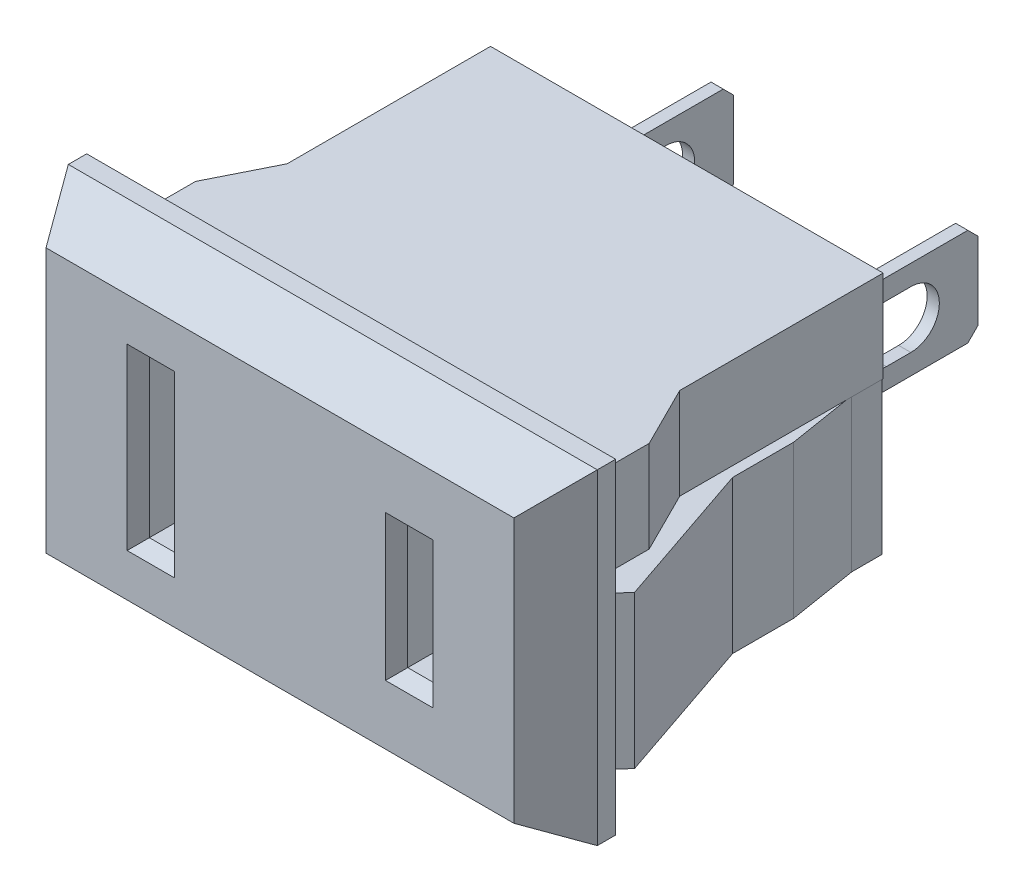
from build123d import *

# Parameters (mm, degrees)
BOSS_EXTRUDE1_DEPTH = 16
SKETCH2_W           = 1.5
SKETCH2_H           = 16
BOSS_EXTRUDE2_DEPTH = 0.8
SKETCH3_W           = 16.5
SKETCH3_H           = 16
BOSS_EXTRUDE3_DEPTH = 20.8
SKETCH4_W           = 24.15
SKETCH4_H           = 16
BOSS_EXTRUDE4_DEPTH = 3.5
CUT_EXTRUDE1_DEPTH  = 6.5
CUT_EXTRUDE2_DEPTH  = 2
CUT_EXTRUDE3_DEPTH  = 2
SKETCH8_W           = 3
SKETCH8_H           = 7
CUT_EXTRUDE4_DEPTH  = 2.5
CUT_EXTRUDE5_DEPTH  = 1
SKETCH10_W          = 3.5
SKETCH10_H          = 16
BOSS_EXTRUDE5_DEPTH = 1.85
SKETCH11_W          = 2
SKETCH11_H          = 16.5
CUT_EXTRUDE6_DEPTH  = 9.8
SKETCH12_W          = 16.5
SKETCH12_H          = 1
CUT_EXTRUDE7_DEPTH  = 5.5
BOSS_EXTRUDE6_DEPTH = 7.5
CUT_EXTRUDE8_DEPTH  = 7.5
CUT_EXTRUDE9_DEPTH  = 7.5
SKETCH16_W          = 0.6
SKETCH16_H          = 7
BOSS_EXTRUDE7_DEPTH = 8
SKETCH17_W          = 6.5
SKETCH17_H          = 1.1
CUT_EXTRUDE10_DEPTH = 33.205641493
SKETCH18_W          = 6.5
SKETCH18_H          = 1.1
CUT_EXTRUDE11_DEPTH = 33.205641493
SKETCH19_W          = 0.6
SKETCH19_H          = 7
BOSS_EXTRUDE8_DEPTH = 8
SKETCH20_W          = 6.5
SKETCH20_H          = 1.1
CUT_EXTRUDE12_DEPTH = 32.849473214
SKETCH21_W          = 6.5
SKETCH21_H          = 1.1
CUT_EXTRUDE13_DEPTH = 32.849473214
CUT_EXTRUDE14_REACH = 33.068
CUT_EXTRUDE15_REACH = 34.206
CUT_EXTRUDE16_DEPTH = 32.849473214
CUT_EXTRUDE17_DEPTH = 7.5
CUT_EXTRUDE18_DEPTH = 1.5
CUT_EXTRUDE19_DEPTH = 1.5
SKETCH28_W          = 1.524
SKETCH28_H          = 7.988
CUT_EXTRUDE20_DEPTH = 18
SKETCH29_W          = 1.524
SKETCH29_H          = 6.35
CUT_EXTRUDE21_DEPTH = 18
CHAMFER1_SIZE       = 0.5
CHAMFER2_SIZE       = 0.528136002
CHAMFER2_SIZE2      = 0.608008164
CHAMFER3_SIZE       = 0.4
CHAMFER3_SIZE2      = 0.692820323
CHAMFER4_SIZE       = 0.608008164
CHAMFER4_SIZE2      = 0.528136002
CHAMFER5_SIZE       = 1.5
CHAMFER5_SIZE2      = 2.598076211


with BuildPart() as part:
    # Sketch1 → Boss-Extrude1 (new body)
    with BuildSketch(Plane.XZ.offset(8)):
        Polygon((12.803267754, -0.8), (9.65, -0.8), (9.65, -14.690909091), (10.15, -11.6), (10.15, -8.6), align=None)
    extrude(amount=-BOSS_EXTRUDE1_DEPTH)

    # Sketch2 → Boss-Extrude2 (add)
    with BuildSketch(Plane.XY.offset(-0.8)):
        with Locations((10.4, 0)):
            Rectangle(SKETCH2_W, SKETCH2_H)
    extrude(amount=BOSS_EXTRUDE2_DEPTH)

    # Sketch3 → Boss-Extrude3 (add)
    with BuildSketch(Plane.ZY.offset(-9.65)):
        with Locations((-8.25, 0)):
            Rectangle(SKETCH3_W, SKETCH3_H)
    extrude(amount=BOSS_EXTRUDE3_DEPTH)

    # Sketch4 → Boss-Extrude4 (add)
    with BuildSketch(Plane.XY):
        with Locations((0.925, 0)):
            Rectangle(SKETCH4_W, SKETCH4_H)
    extrude(amount=BOSS_EXTRUDE4_DEPTH)

    # Sketch5 → Cut-Extrude1 (cut)
    with BuildSketch(Plane(origin=(0, 8, 0), x_dir=(-1, 0, 0), z_dir=(0, 1, 0))):
        Polygon((-9.65, -14.690909091), (-9.65, -6.5), (-11.15, -3.5), (-11.15, -0.8), (-12.803267754, -0.8), (-10.15, -8.6), (-10.15, -11.6), align=None)
    extrude(amount=-CUT_EXTRUDE1_DEPTH, mode=Mode.SUBTRACT)

    # Sketch6 → Cut-Extrude2 (cut)
    with BuildSketch(Plane(origin=(0, 8, 0), x_dir=(-1, 0, 0), z_dir=(0, 1, 0))):
        Polygon((-11.15, 0), (-11.15, -3.5), (-9.65, -6.5), (-9.65, -16.5), (11.15, -16.5), (11.15, 0), align=None)
    extrude(amount=-CUT_EXTRUDE2_DEPTH, mode=Mode.SUBTRACT)

    # Sketch7 → Cut-Extrude3 (cut)
    with BuildSketch(Plane.XZ.offset(8)):
        Polygon((11.15, -0.8), (11.15, 0), (-11.15, 0), (-11.15, -16.5), (9.65, -16.5), (9.65, -14.690909091), (10.15, -11.6), (10.15, -8.6), (12.803267754, -0.8), align=None)
    extrude(amount=-CUT_EXTRUDE3_DEPTH, mode=Mode.SUBTRACT)

    # Sketch8 → Cut-Extrude4 (cut)
    with BuildSketch(Plane.XZ.offset(6)):
        with Locations((0, -3.5)):
            Rectangle(SKETCH8_W, SKETCH8_H)
    extrude(amount=-CUT_EXTRUDE4_DEPTH, mode=Mode.SUBTRACT)

    # Sketch9 → Cut-Extrude5 (cut)
    with BuildSketch(Plane.XZ.offset(6)):
        Polygon((-1.5, -7), (-1.5, -16.5), (7, -16.5), (7, 0), (1.5, 0), (1.5, -7), align=None)
    extrude(amount=-CUT_EXTRUDE5_DEPTH, mode=Mode.SUBTRACT)

    # Sketch10 → Boss-Extrude5 (add)
    with BuildSketch(Plane.ZY.offset(11.15)):
        with Locations((1.75, 0)):
            Rectangle(SKETCH10_W, SKETCH10_H)
    extrude(amount=BOSS_EXTRUDE5_DEPTH)

    # Sketch11 → Cut-Extrude6 (cut)
    with BuildSketch(Plane.XZ.offset(6)):
        with Locations((-10.15, -8.25)):
            Rectangle(SKETCH11_W, SKETCH11_H)
    extrude(amount=-CUT_EXTRUDE6_DEPTH, mode=Mode.SUBTRACT)

    # Sketch12 → Cut-Extrude7 (cut)
    with BuildSketch(Plane(origin=(-1.5, 0, 0), x_dir=(0, 0, -1), z_dir=(1, 0, 0))):
        with Locations((8.25, -5.5)):
            Rectangle(SKETCH12_W, SKETCH12_H)
    extrude(amount=-CUT_EXTRUDE7_DEPTH, mode=Mode.SUBTRACT)

    # Sketch13 → Boss-Extrude6 (add)
    with BuildSketch(Plane.XZ.offset(6)):
        Polygon((-9.15, -6.566987298), (-10.695259589, -0.8), (-12.803267754, -0.8), (-10.15, -8.6), (-10.15, -11.6), (-9.6, -15), (-9.6, -16.5), (-9.15, -16.5), align=None)
    extrude(amount=-BOSS_EXTRUDE6_DEPTH)

    # Sketch14 → Cut-Extrude8 (cut)
    with BuildSketch(Plane.XZ.offset(6)):
        with BuildLine():
            Line((-9.15, 0), (-9.15, -6.566987298))
            Line((-9.15, -6.566987298), (-8.9, -7.5))
            Line((-8.9, -7.5), (-8.9, -9.5))
            ThreePointArc((-8.9, -9.5), (-8.45, -9.95), (-8, -9.5))
            Line((-8, -9.5), (-8, 0))
            Line((-8, 0), (-9.15, 0))
        make_face()
    extrude(amount=-CUT_EXTRUDE8_DEPTH, mode=Mode.SUBTRACT)

    # Sketch15 → Cut-Extrude9 (cut)
    with BuildSketch(Plane.XZ.offset(6)):
        with BuildLine():
            Line((8.9, -9.5), (8.9, -7.5))
            Line((8.9, -7.5), (10.695259589, -0.8))
            Line((10.695259589, -0.8), (11.15, -0.8))
            Line((11.15, -0.8), (11.15, 0))
            Line((11.15, 0), (8, 0))
            Line((8, 0), (8, -9.5))
            ThreePointArc((8, -9.5), (8.45, -9.95), (8.9, -9.5))
        make_face()
    extrude(amount=-CUT_EXTRUDE9_DEPTH, mode=Mode.SUBTRACT)

    # Sketch16 → Boss-Extrude7 (add)
    with BuildSketch(Plane(origin=(0, 0, -16.5), x_dir=(-1, 0, 0), z_dir=(0, 0, -1))):
        with Locations((-6.012, 0)):
            Rectangle(SKETCH16_W, SKETCH16_H)
    extrude(amount=BOSS_EXTRUDE7_DEPTH)

    # Sketch17 → Cut-Extrude10 (cut, through all)
    with BuildSketch(Plane(origin=(6.312, 0, 0), x_dir=(0, 0, -1), z_dir=(1, 0, 0))):
        with Locations((21.25, 2.95)):
            Rectangle(SKETCH17_W, SKETCH17_H)
    extrude(amount=-CUT_EXTRUDE10_DEPTH, mode=Mode.SUBTRACT)

    # Sketch18 → Cut-Extrude11 (cut, through all)
    with BuildSketch(Plane(origin=(6.312, 0, 0), x_dir=(0, 0, -1), z_dir=(1, 0, 0))):
        with Locations((21.25, -2.95)):
            Rectangle(SKETCH18_W, SKETCH18_H)
    extrude(amount=-CUT_EXTRUDE11_DEPTH, mode=Mode.SUBTRACT)

    # Sketch19 → Boss-Extrude8 (add)
    with BuildSketch(Plane(origin=(0, 0, -16.5), x_dir=(-1, 0, 0), z_dir=(0, 0, -1))):
        with Locations((6.012, 0)):
            Rectangle(SKETCH19_W, SKETCH19_H)
    extrude(amount=BOSS_EXTRUDE8_DEPTH)

    # Sketch20 → Cut-Extrude12 (cut, through all)
    with BuildSketch(Plane(origin=(-5.712, 0, 0), x_dir=(0, 0, -1), z_dir=(1, 0, 0))):
        with Locations((21.25, 2.95)):
            Rectangle(SKETCH20_W, SKETCH20_H)
    extrude(amount=-CUT_EXTRUDE12_DEPTH, mode=Mode.SUBTRACT)

    # Sketch21 → Cut-Extrude13 (cut, through all)
    with BuildSketch(Plane(origin=(-5.712, 0, 0), x_dir=(0, 0, -1), z_dir=(1, 0, 0))):
        with Locations((21.25, -2.95)):
            Rectangle(SKETCH21_W, SKETCH21_H)
    extrude(amount=-CUT_EXTRUDE13_DEPTH, mode=Mode.SUBTRACT)

    # Sketch22 → Cut-Extrude14 (cut, up to next)
    with BuildSketch(Plane(origin=(0, 6, 0), x_dir=(-1, 0, 0), z_dir=(0, 1, 0)), mode=Mode.PRIVATE) as cut_extrude14_sk1:
        Polygon((11.15, -3.5), (9.65, -6.5), (9.65, -16.5), (11.15, -16.5), align=None)
    cut_extrude14_tool1 = extrude(cut_extrude14_sk1.sketch, amount=-CUT_EXTRUDE14_REACH, mode=Mode.PRIVATE) & part.part
    add(cut_extrude14_tool1.solids().sort_by_distance((-10.432609, 6, -10.717391))[0], mode=Mode.SUBTRACT)

    # Sketch23 → Cut-Extrude15 (cut, up to next)
    with BuildSketch(Plane(origin=(6.312, 0, 0), x_dir=(0, 0, -1), z_dir=(1, 0, 0)), mode=Mode.PRIVATE) as cut_extrude15_sk1:
        with BuildLine():
            Line((20, -1.4), (21.2, -1.4))
            ThreePointArc((21.2, -1.4), (22.6, 0), (21.2, 1.4))
            Line((21.2, 1.4), (20, 1.4))
            ThreePointArc((20, 1.4), (18.6, 0), (20, -1.4))
        make_face()
    cut_extrude15_tool1 = extrude(cut_extrude15_sk1.sketch, amount=-CUT_EXTRUDE15_REACH, mode=Mode.PRIVATE) & part.part
    add(cut_extrude15_tool1.solids().sort_by_distance((6.312, 0, -20.6))[0], mode=Mode.SUBTRACT)

    # Sketch24 → Cut-Extrude16 (cut, through all)
    with BuildSketch(Plane(origin=(-5.712, 0, 0), x_dir=(0, 0, -1), z_dir=(1, 0, 0))):
        with BuildLine():
            Line((20, -1.4), (21.2, -1.4))
            ThreePointArc((21.2, -1.4), (22.6, 0), (21.2, 1.4))
            Line((21.2, 1.4), (20, 1.4))
            ThreePointArc((20, 1.4), (18.6, 0), (20, -1.4))
        make_face()
    extrude(amount=-CUT_EXTRUDE16_DEPTH, mode=Mode.SUBTRACT)

    # Sketch25 → Cut-Extrude17 (cut)
    with BuildSketch(Plane.XZ.offset(6)):
        Polygon((9.6, -15), (9.6, -16.5), (9.65, -16.5), (9.65, -14.690909091), align=None)
    extrude(amount=-CUT_EXTRUDE17_DEPTH, mode=Mode.SUBTRACT)

    # Sketch26 → Cut-Extrude18 (cut)
    with BuildSketch(Plane.XZ.offset(5)):
        Polygon((2.2, -13.5), (3.191, -13.5), (3.191, -8.5), (1, -8.5), (1, -12.7), (2.2, -12.7), align=None)
    extrude(amount=-CUT_EXTRUDE18_DEPTH, mode=Mode.SUBTRACT)

    # Sketch27 → Cut-Extrude19 (cut)
    with BuildSketch(Plane.XZ.offset(5)):
        Polygon((-2.2, -13.5), (-2.2, -12.7), (-1, -12.7), (-1, -8.5), (-3.191, -8.5), (-3.191, -13.5), align=None)
    extrude(amount=-CUT_EXTRUDE19_DEPTH, mode=Mode.SUBTRACT)

    # Sketch28 → Cut-Extrude20 (cut)
    with BuildSketch(Plane.XY.offset(3.5)):
        with Locations((-6.35, 0)):
            Rectangle(SKETCH28_W, SKETCH28_H)
    extrude(amount=-CUT_EXTRUDE20_DEPTH, mode=Mode.SUBTRACT)

    # Sketch29 → Cut-Extrude21 (cut)
    with BuildSketch(Plane.XY.offset(3.5)):
        with Locations((6.35, 0)):
            Rectangle(SKETCH29_W, SKETCH29_H)
    extrude(amount=-CUT_EXTRUDE21_DEPTH, mode=Mode.SUBTRACT)

    # Chamfer1
    chamfer1_edges = [part.edges().sort_by_distance(p)[0] for p in [
        (6.012, 2.4, -24.5),
        (6.012, -2.4, -24.5),
        (-6.012, 2.4, -24.5),
        (-6.012, -2.4, -24.5),
    ]]
    chamfer(chamfer1_edges, length=CHAMFER1_SIZE)

    # Chamfer2
    chamfer2_edges = [part.edges().sort_by_distance(p)[0] for p in [
        (-12.803267754, -2.25, -0.8),
    ]]
    chamfer2_side = [part.faces().sort_by_distance(p)[0] for p in [
        (-11.476633877, -2.25, -4.7),
    ]]
    chamfer(chamfer2_edges, length=CHAMFER2_SIZE, length2=CHAMFER2_SIZE2, reference=chamfer2_side[0])

    # Chamfer3
    chamfer3_edges = [part.edges().sort_by_distance(p)[0] for p in [
        (-6.35, -3.994, 3.5),
        (-5.588, 0, 3.5),
        (-6.35, 3.994, 3.5),
        (-7.112, 0, 3.5),
        (6.35, -3.175, 3.5),
        (7.112, 0, 3.5),
        (6.35, 3.175, 3.5),
        (5.588, 0, 3.5),
    ]]
    chamfer3_side = [part.faces().sort_by_distance(p)[0] for p in [
        (0.040217242, 0, 3.5),
    ]]
    chamfer(chamfer3_edges, length=CHAMFER3_SIZE, length2=CHAMFER3_SIZE2, reference=chamfer3_side[0])

    # Chamfer4
    chamfer4_edges = [part.edges().sort_by_distance(p)[0] for p in [
        (12.803267754, -2.25, -0.8),
    ]]
    chamfer4_side = [part.faces().sort_by_distance(p)[0] for p in [
        (11.749263671, -2.25, -0.8),
    ]]
    chamfer(chamfer4_edges, length=CHAMFER4_SIZE, length2=CHAMFER4_SIZE2, reference=chamfer4_side[0])

    # Chamfer5
    chamfer5_edges = [part.edges().sort_by_distance(p)[0] for p in [
        (-13, 0, 3.5),
        (0, -8, 3.5),
        (13, 0, 3.5),
        (0, 8, 3.5),
    ]]
    chamfer5_side = [part.faces().sort_by_distance(p)[0] for p in [
        (0.06378672, 0, 3.5),
    ]]
    chamfer(chamfer5_edges, length=CHAMFER5_SIZE, length2=CHAMFER5_SIZE2, reference=chamfer5_side[0])


solid = part.part
